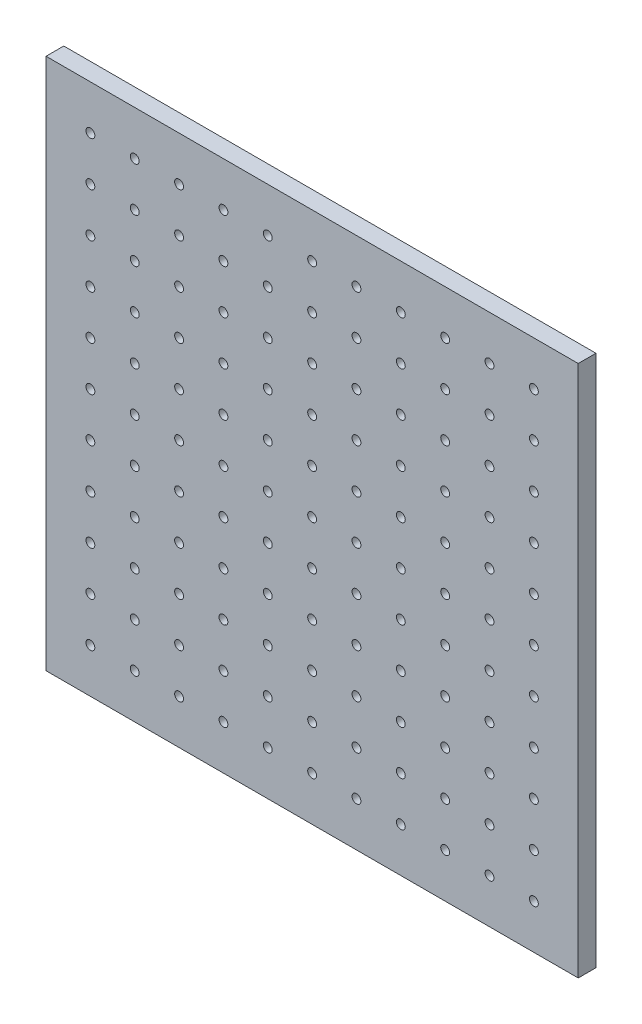
from build123d import *

# Parameters (mm, degrees)
SKETCH_1_W                  = 300
SKETCH_1_H                  = 300
EXTRUDE_1_DEPTH             = 10
PATTERN_LINEAR_1_COUNT      = 11
PATTERN_LINEAR_1_PITCH      = 25
PATTERN_LINEAR_1_COUNT_DIR2 = 11
PATTERN_LINEAR_1_PITCH_DIR2 = 25


with BuildPart() as part:
    # 草图1 → 凸台-拉伸1 (new body)
    with BuildSketch(Plane.XY):
        Rectangle(SKETCH_1_W, SKETCH_1_H)
    extrude(amount=EXTRUDE_1_DEPTH)

    # 草图3 → M6 螺纹孔1 (revolve, cut)
    with BuildSketch(Plane(origin=(-125, -125, 10), x_dir=(0, -1, 0), z_dir=(1, 0, 0))):
        Polygon((0, 0), (0, 16.502151548), (2.5, 15), (2.5, 0), align=None)
    hole_wizard_m6_1 = revolve(axis=Axis((-125, -125, 16.35), (0, 0, -1)), mode=Mode.SUBTRACT)

    # 阵列(线性)1: Hole Wizard M6 _1 11 × 11
    with Locations(*[(j * PATTERN_LINEAR_1_PITCH_DIR2, i * PATTERN_LINEAR_1_PITCH, 0) for i in range(PATTERN_LINEAR_1_COUNT) for j in range(PATTERN_LINEAR_1_COUNT_DIR2) if (i, j) != (0, 0)]):
        add(hole_wizard_m6_1, mode=Mode.SUBTRACT)


solid = part.part
